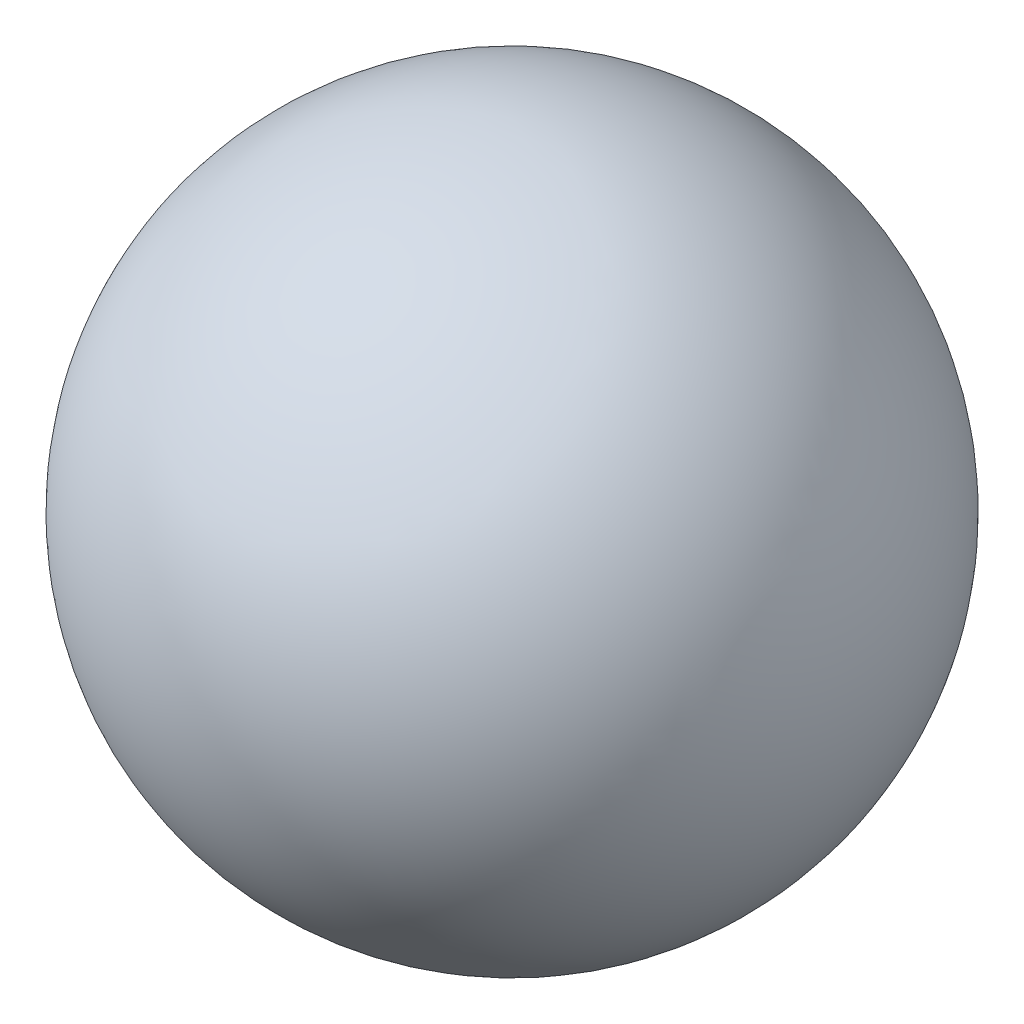
from build123d import *


with BuildPart() as part:
    # Sketch1 → Revolve1 (revolve)
    with BuildSketch(Plane.XY):
        with BuildLine():
            Line((-40, 0), (40, 0))
            ThreePointArc((40, 0), (0, 40), (-40, 0))
        make_face()
    revolve(axis=Axis((-40, 0, 0), (1, 0, 0)))


solid = part.part
